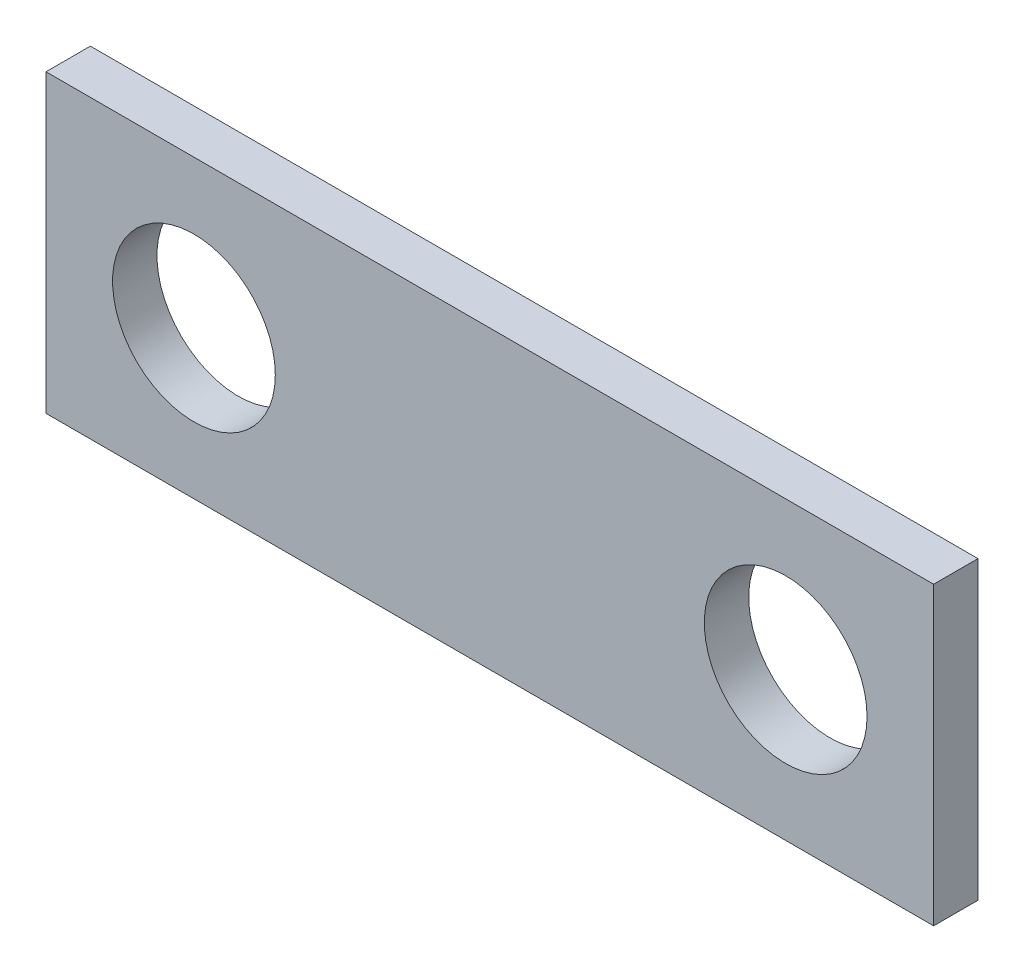
from build123d import *

# Parameters (mm, degrees)
CROQUIS1_W              = 60
CROQUIS1_H              = 20
SALIENTE_EXTRUIR1_DEPTH = 3
CROQUIS2_R              = 5.5
CORTAR_EXTRUIR1_DEPTH   = 3


with BuildPart() as part:
    # Croquis1 → Saliente-Extruir1 (new body)
    with BuildSketch(Plane.XY):
        Rectangle(CROQUIS1_W, CROQUIS1_H)
    extrude(amount=SALIENTE_EXTRUIR1_DEPTH)

    # Croquis2 → Cortar-Extruir1 (cut)
    with BuildSketch(Plane.XY.offset(3)):
        with Locations((-20, 0)):
            Circle(CROQUIS2_R)
        with Locations((20, 0)):
            Circle(CROQUIS2_R)
    extrude(amount=-CORTAR_EXTRUIR1_DEPTH, mode=Mode.SUBTRACT)


solid = part.part
